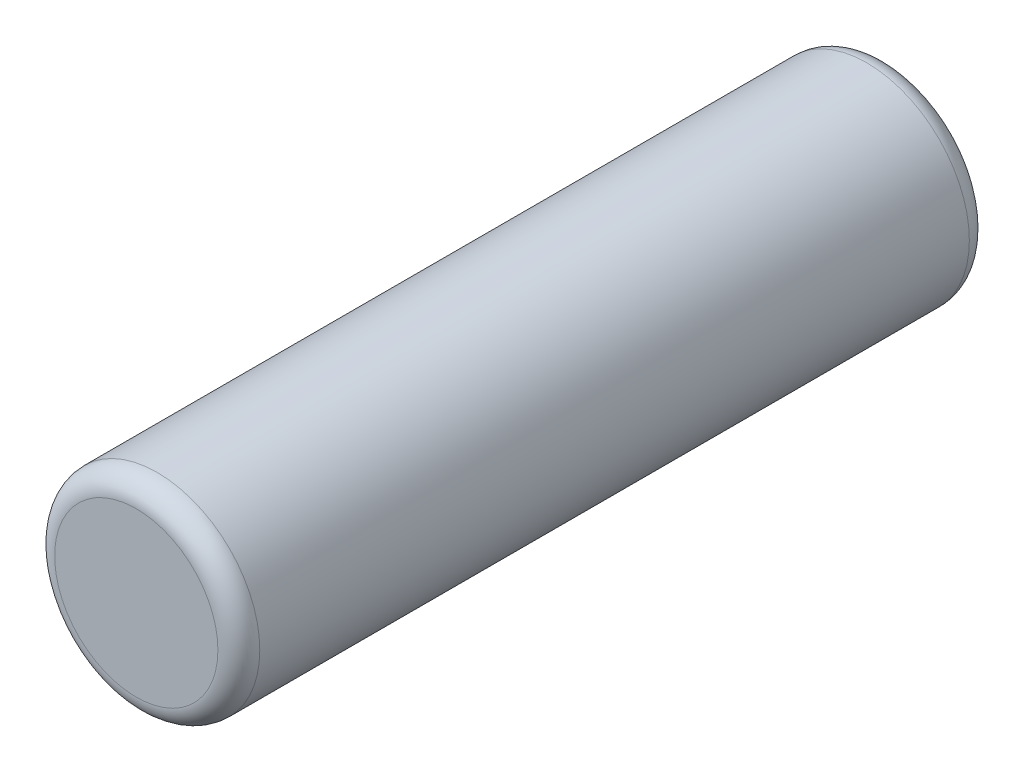
from build123d import *

# Parameters (mm, degrees)
SKETCH_1_R      = 2.45
EXTRUDE_1_DEPTH = 17.95
FILLET_1_R      = 0.5


with BuildPart() as part:
    # 스케치1 → 보스-돌출1 (new body)
    with BuildSketch(Plane.XY):
        Circle(SKETCH_1_R)
    extrude(amount=EXTRUDE_1_DEPTH)

    # 필렛1
    fillet_1_edges = [part.edges().sort_by_distance(p)[0] for p in [
        (-2.45, 0, 0),
        (-2.45, 0, 17.95),
    ]]
    fillet(fillet_1_edges, radius=FILLET_1_R)


solid = part.part
